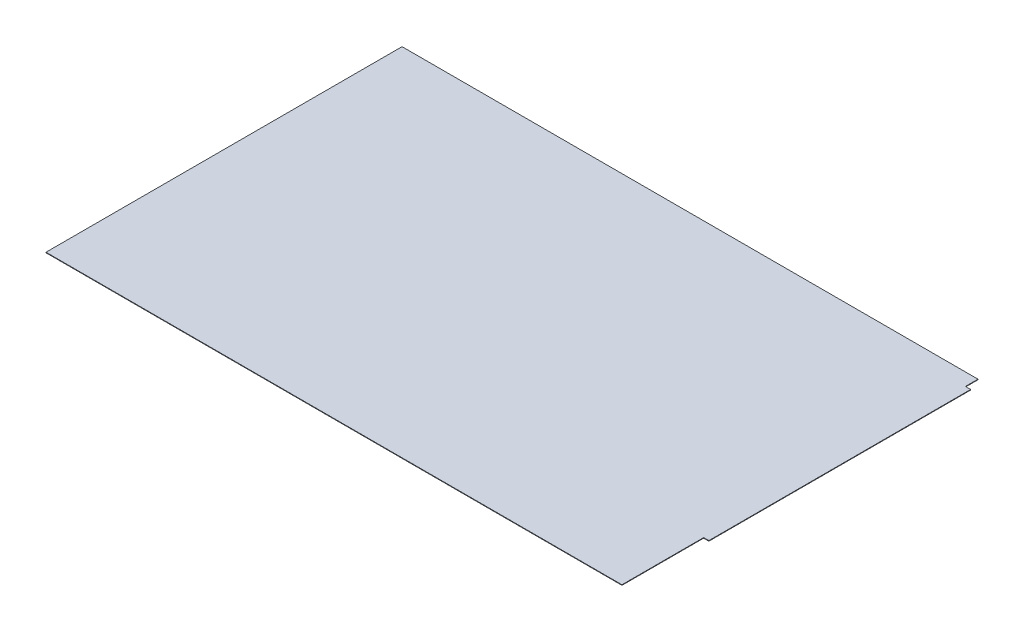
from build123d import *

# Parameters (mm, degrees)
SKETCH2_W           = 5500
SKETCH2_H           = 3400
BOSS_EXTRUDE1_DEPTH = 5
SKETCH3_W           = 50
SKETCH3_H           = 2500
BOSS_EXTRUDE2_DEPTH = 5


with BuildPart() as part:
    # Sketch2 → Boss-Extrude1 (new body)
    with BuildSketch(Plane(origin=(0, 0, 0), x_dir=(1, 0, 0), z_dir=(0, 1, 0))):
        Rectangle(SKETCH2_W, SKETCH2_H)
    extrude(amount=BOSS_EXTRUDE1_DEPTH)

    # Sketch3 → Boss-Extrude2 (add)
    with BuildSketch(Plane(origin=(0, 5, 0), x_dir=(1, 0, 0), z_dir=(0, 1, 0))):
        with Locations((2775, 330)):
            Rectangle(SKETCH3_W, SKETCH3_H)
    extrude(amount=-BOSS_EXTRUDE2_DEPTH)


solid = part.part
